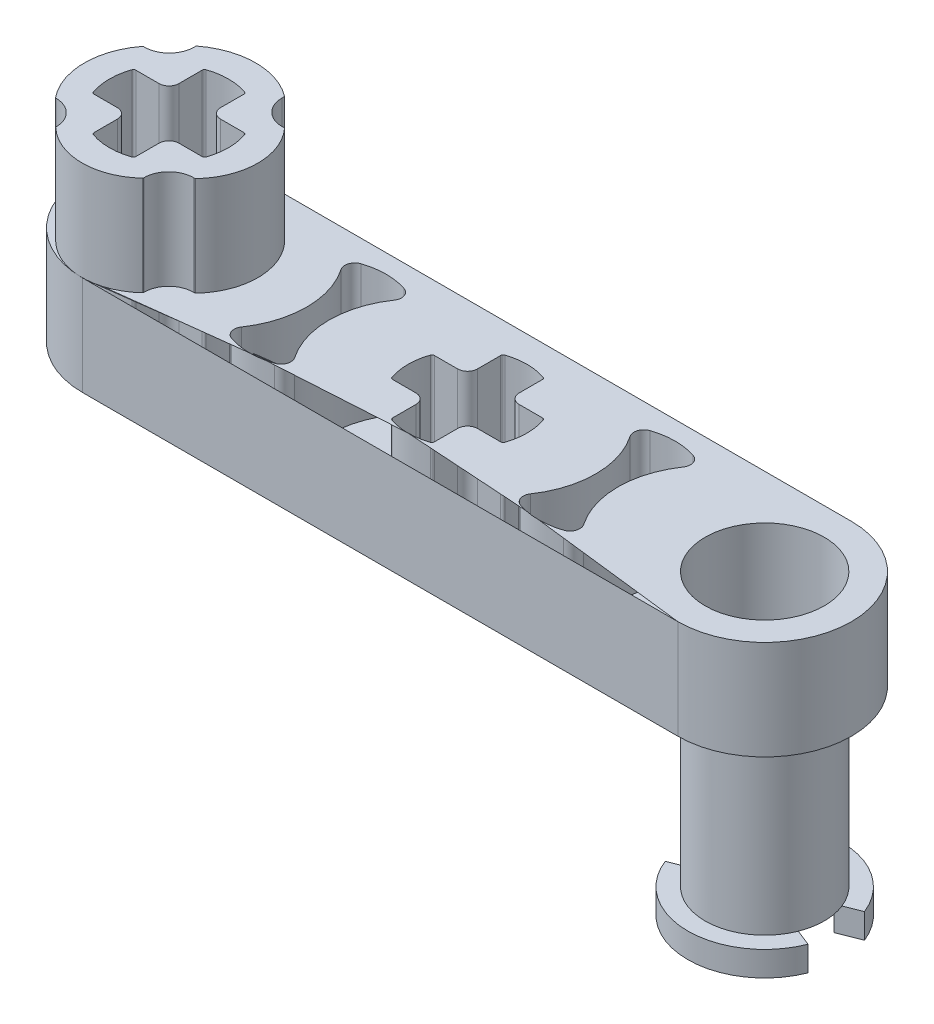
from build123d import *

# Parameters (mm, degrees)
SKETCH2_R           = 2.4
BOSS_EXTRUDE1_DEPTH = 2
BOSS_EXTRUDE2_DEPTH = 4
SKETCH2_2_OUTSIDE_W = 39.554
SKETCH2_2_OUTSIDE_H = 15.554
SKETCH2_2_OUTSIDE_R = 2.4
CUT_EXTRUDE1_DEPTH  = 8
SKETCH5_R           = 2.4
SKETCH5_R_2         = 2.15
BOSS_EXTRUDE3_DEPTH = 7
BOSS_EXTRUDE4_DEPTH = 1


with BuildPart() as part:
    # Sketch2 → Boss-Extrude1 (new, symmetric)
    with BuildSketch(Plane(origin=(0, 0, 0), x_dir=(1, 0, 0), z_dir=(0, 1, 0))):
        with BuildLine():
            Line((-4.44, 3.5), (19.56, 3.5))
            ThreePointArc((19.56, 3.5), (23.06, 0), (19.56, -3.5))
            Line((19.56, -3.5), (-4.44, -3.5))
            ThreePointArc((-4.44, -3.5), (-7.94, 0), (-4.44, 3.5))
        make_face()
        with Locations((19.56, 0)):
            Circle(SKETCH2_R, mode=Mode.SUBTRACT)
        with BuildLine():
            Line((-5.279975377, -1.253128504), (-5.279975377, -2.190833718))
            ThreePointArc((-5.279975377, -2.190833718), (-5.261269262, -2.249068625), (-5.21214929, -2.285516554))
            ThreePointArc((-5.21214929, -2.285516554), (-4.439975377, -2.413128504), (-3.667801464, -2.285516554))
            ThreePointArc((-3.667801464, -2.285516554), (-3.618681493, -2.249068625), (-3.599975377, -2.190833718))
            Line((-3.599975377, -2.190833718), (-3.599975377, -1.253128504))
            ThreePointArc((-3.599975377, -1.253128504), (-3.48281809, -0.970285792), (-3.199975377, -0.853128504))
            Line((-3.199975377, -0.853128504), (-2.262270163, -0.853128504))
            ThreePointArc((-2.262270163, -0.853128504), (-2.204035257, -0.834422389), (-2.167587328, -0.785302417))
            ThreePointArc((-2.167587328, -0.785302417), (-2.039975377, -0.013128504), (-2.167587328, 0.759045409))
            ThreePointArc((-2.167587328, 0.759045409), (-2.204035257, 0.80816538), (-2.262270163, 0.826871496))
            Line((-2.262270163, 0.826871496), (-3.199975377, 0.826871496))
            ThreePointArc((-3.199975377, 0.826871496), (-3.48281809, 0.944028783), (-3.599975377, 1.226871496))
            Line((-3.599975377, 1.226871496), (-3.599975377, 2.16457671))
            ThreePointArc((-3.599975377, 2.16457671), (-3.618681493, 2.222811617), (-3.667801464, 2.259259545))
            ThreePointArc((-3.667801464, 2.259259545), (-4.439975377, 2.386871496), (-5.21214929, 2.259259545))
            ThreePointArc((-5.21214929, 2.259259545), (-5.261269262, 2.222811617), (-5.279975377, 2.16457671))
            Line((-5.279975377, 2.16457671), (-5.279975377, 1.226871496))
            ThreePointArc((-5.279975377, 1.226871496), (-5.397132665, 0.944028783), (-5.679975377, 0.826871496))
            Line((-5.679975377, 0.826871496), (-6.617680592, 0.826871496))
            ThreePointArc((-6.617680592, 0.826871496), (-6.675915498, 0.80816538), (-6.712363427, 0.759045409))
            ThreePointArc((-6.712363427, 0.759045409), (-6.839975377, -0.013128504), (-6.712363427, -0.785302417))
            ThreePointArc((-6.712363427, -0.785302417), (-6.675915498, -0.834422389), (-6.617680592, -0.853128504))
            Line((-6.617680592, -0.853128504), (-5.679975377, -0.853128504))
            ThreePointArc((-5.679975377, -0.853128504), (-5.397132665, -0.970285792), (-5.279975377, -1.253128504))
        make_face(mode=Mode.SUBTRACT)
        with BuildLine():
            Line((6.697861167, -1.195612727), (6.697861167, -2.133317941))
            ThreePointArc((6.697861167, -2.133317941), (6.716567283, -2.191552847), (6.765687254, -2.228000776))
            ThreePointArc((6.765687254, -2.228000776), (7.537861167, -2.355612727), (8.31003508, -2.228000776))
            ThreePointArc((8.31003508, -2.228000776), (8.359155052, -2.191552847), (8.377861167, -2.133317941))
            Line((8.377861167, -2.133317941), (8.377861167, -1.195612727))
            ThreePointArc((8.377861167, -1.195612727), (8.495018455, -0.912770014), (8.777861167, -0.795612727))
            Line((8.777861167, -0.795612727), (9.715566381, -0.795612727))
            ThreePointArc((9.715566381, -0.795612727), (9.773801288, -0.776906611), (9.810249217, -0.72778664))
            ThreePointArc((9.810249217, -0.72778664), (9.937861167, 0.044387273), (9.810249217, 0.816561186))
            ThreePointArc((9.810249217, 0.816561186), (9.773801288, 0.865681158), (9.715566381, 0.884387273))
            Line((9.715566381, 0.884387273), (8.777861167, 0.884387273))
            ThreePointArc((8.777861167, 0.884387273), (8.495018455, 1.001544561), (8.377861167, 1.284387273))
            Line((8.377861167, 1.284387273), (8.377861167, 2.222092488))
            ThreePointArc((8.377861167, 2.222092488), (8.359155052, 2.280327394), (8.31003508, 2.316775323))
            ThreePointArc((8.31003508, 2.316775323), (7.537861167, 2.444387273), (6.765687254, 2.316775323))
            ThreePointArc((6.765687254, 2.316775323), (6.716567283, 2.280327394), (6.697861167, 2.222092488))
            Line((6.697861167, 2.222092488), (6.697861167, 1.284387273))
            ThreePointArc((6.697861167, 1.284387273), (6.58070388, 1.001544561), (6.297861167, 0.884387273))
            Line((6.297861167, 0.884387273), (5.360155953, 0.884387273))
            ThreePointArc((5.360155953, 0.884387273), (5.301921046, 0.865681158), (5.265473118, 0.816561186))
            ThreePointArc((5.265473118, 0.816561186), (5.137861167, 0.044387273), (5.265473118, -0.72778664))
            ThreePointArc((5.265473118, -0.72778664), (5.301921046, -0.776906611), (5.360155953, -0.795612727))
            Line((5.360155953, -0.795612727), (6.297861167, -0.795612727))
            ThreePointArc((6.297861167, -0.795612727), (6.58070388, -0.912770014), (6.697861167, -1.195612727))
        make_face(mode=Mode.SUBTRACT)
        with BuildLine():
            ThreePointArc((0.682985448, -2.610099174), (1.548942895, -2.75), (2.414900342, -2.610099174))
            ThreePointArc((2.414900342, -2.610099174), (2.667976494, -2.358251088), (2.619069477, -2.004580194))
            ThreePointArc((2.619069477, -2.004580194), (1.998942895, 0), (2.619069477, 2.004580194))
            ThreePointArc((2.619069477, 2.004580194), (2.667976494, 2.358251088), (2.414900342, 2.610099174))
            ThreePointArc((2.414900342, 2.610099174), (1.548942895, 2.75), (0.682985448, 2.610099174))
            ThreePointArc((0.682985448, 2.610099174), (0.429909296, 2.358251088), (0.478816313, 2.004580194))
            ThreePointArc((0.478816313, 2.004580194), (1.098942895, 0), (0.478816313, -2.004580194))
            ThreePointArc((0.478816313, -2.004580194), (0.429909296, -2.358251088), (0.682985448, -2.610099174))
        make_face(mode=Mode.SUBTRACT)
        with BuildLine():
            ThreePointArc((12.332973137, -2.610099174), (13.198930584, -2.75), (14.06488803, -2.610099174))
            ThreePointArc((14.06488803, -2.610099174), (14.317964183, -2.358251088), (14.269057166, -2.004580194))
            ThreePointArc((14.269057166, -2.004580194), (13.648930584, 0), (14.269057166, 2.004580194))
            ThreePointArc((14.269057166, 2.004580194), (14.317964183, 2.358251088), (14.06488803, 2.610099174))
            ThreePointArc((14.06488803, 2.610099174), (13.198930584, 2.75), (12.332973137, 2.610099174))
            ThreePointArc((12.332973137, 2.610099174), (12.079896985, 2.358251088), (12.128804001, 2.004580194))
            ThreePointArc((12.128804001, 2.004580194), (12.748930584, 0), (12.128804001, -2.004580194))
            ThreePointArc((12.128804001, -2.004580194), (12.079896985, -2.358251088), (12.332973137, -2.610099174))
        make_face(mode=Mode.SUBTRACT)
    extrude(amount=BOSS_EXTRUDE1_DEPTH, both=True)

    # Sketch3 → Boss-Extrude2 (add)
    with BuildSketch(Plane(origin=(0, 2, 0), x_dir=(1, 0, 0), z_dir=(0, 1, 0))):
        with BuildLine():
            Line((-2.699812111, 2.806112945), (-2.699812111, 2.90874331))
            ThreePointArc((-2.699812111, 2.90874331), (-4.476002964, 3.49955548), (-6.244349616, 2.88566373))
            Line((-6.244349616, 2.88566373), (-6.244349616, 2.806112945))
            ThreePointArc((-6.244349616, 2.806112945), (-6.537242835, 2.099006164), (-7.244349616, 1.806112945))
            Line((-7.244349616, 1.806112945), (-7.302442476, 1.806112945))
            ThreePointArc((-7.302442476, 1.806112945), (-7.907666717, 0.01604592), (-7.26697999, -1.761637082))
            Line((-7.26697999, -1.761637082), (-7.244349616, -1.761637082))
            ThreePointArc((-7.244349616, -1.761637082), (-6.537242835, -2.054530301), (-6.244349616, -2.761637082))
            Line((-6.244349616, -2.761637082), (-6.244349616, -2.77343784))
            ThreePointArc((-6.244349616, -2.77343784), (-4.47671825, -3.497182541), (-2.699812111, -2.79651742))
            Line((-2.699812111, -2.79651742), (-2.699812111, -2.761637082))
            ThreePointArc((-2.699812111, -2.761637082), (-2.406918892, -2.054530301), (-1.699812111, -1.761637082))
            Line((-1.699812111, -1.761637082), (-1.632644233, -1.761637082))
            ThreePointArc((-1.632644233, -1.761637082), (-0.910113093, 0.015232408), (-1.597181746, 1.806112945))
            Line((-1.597181746, 1.806112945), (-1.699812111, 1.806112945))
            ThreePointArc((-1.699812111, 1.806112945), (-2.406918892, 2.099006164), (-2.699812111, 2.806112945))
        make_face()
    extrude(amount=BOSS_EXTRUDE2_DEPTH)

    # Sketch2<2> outside → Cut-Extrude1 (cut)
    # profile 1 of 6: a face of its own
    with BuildSketch(Plane(origin=(0, 0, 0), x_dir=(1, 0, 0), z_dir=(0, 1, 0))):
        with Locations((7.56, 0)):
            Rectangle(SKETCH2_2_OUTSIDE_W, SKETCH2_2_OUTSIDE_H)
        with BuildLine():
            Line((-4.44, 3.5), (19.56, 3.5))
            ThreePointArc((19.56, 3.5), (23.06, 0), (19.56, -3.5))
            Line((19.56, -3.5), (-4.44, -3.5))
            ThreePointArc((-4.44, -3.5), (-7.94, 0), (-4.44, 3.5))
        make_face(mode=Mode.SUBTRACT)
    # profile 2 of 6: a face of its own
    with BuildSketch(Plane(origin=(0, 0, 0), x_dir=(1, 0, 0), z_dir=(0, 1, 0))):
        with Locations((19.56, 0)):
            Circle(SKETCH2_2_OUTSIDE_R)
    # profile 3 of 6: a face of its own
    with BuildSketch(Plane(origin=(0, 0, 0), x_dir=(1, 0, 0), z_dir=(0, 1, 0))):
        with BuildLine():
            Line((-5.279975377, -1.253128504), (-5.279975377, -2.190833718))
            ThreePointArc((-5.279975377, -2.190833718), (-5.261269262, -2.249068625), (-5.21214929, -2.285516554))
            ThreePointArc((-5.21214929, -2.285516554), (-4.439975377, -2.413128504), (-3.667801464, -2.285516554))
            ThreePointArc((-3.667801464, -2.285516554), (-3.618681493, -2.249068625), (-3.599975377, -2.190833718))
            Line((-3.599975377, -2.190833718), (-3.599975377, -1.253128504))
            ThreePointArc((-3.599975377, -1.253128504), (-3.48281809, -0.970285792), (-3.199975377, -0.853128504))
            Line((-3.199975377, -0.853128504), (-2.262270163, -0.853128504))
            ThreePointArc((-2.262270163, -0.853128504), (-2.204035257, -0.834422389), (-2.167587328, -0.785302417))
            ThreePointArc((-2.167587328, -0.785302417), (-2.039975377, -0.013128504), (-2.167587328, 0.759045409))
            ThreePointArc((-2.167587328, 0.759045409), (-2.204035257, 0.80816538), (-2.262270163, 0.826871496))
            Line((-2.262270163, 0.826871496), (-3.199975377, 0.826871496))
            ThreePointArc((-3.199975377, 0.826871496), (-3.48281809, 0.944028783), (-3.599975377, 1.226871496))
            Line((-3.599975377, 1.226871496), (-3.599975377, 2.16457671))
            ThreePointArc((-3.599975377, 2.16457671), (-3.618681493, 2.222811617), (-3.667801464, 2.259259545))
            ThreePointArc((-3.667801464, 2.259259545), (-4.439975377, 2.386871496), (-5.21214929, 2.259259545))
            ThreePointArc((-5.21214929, 2.259259545), (-5.261269262, 2.222811617), (-5.279975377, 2.16457671))
            Line((-5.279975377, 2.16457671), (-5.279975377, 1.226871496))
            ThreePointArc((-5.279975377, 1.226871496), (-5.397132665, 0.944028783), (-5.679975377, 0.826871496))
            Line((-5.679975377, 0.826871496), (-6.617680592, 0.826871496))
            ThreePointArc((-6.617680592, 0.826871496), (-6.675915498, 0.80816538), (-6.712363427, 0.759045409))
            ThreePointArc((-6.712363427, 0.759045409), (-6.839975377, -0.013128504), (-6.712363427, -0.785302417))
            ThreePointArc((-6.712363427, -0.785302417), (-6.675915498, -0.834422389), (-6.617680592, -0.853128504))
            Line((-6.617680592, -0.853128504), (-5.679975377, -0.853128504))
            ThreePointArc((-5.679975377, -0.853128504), (-5.397132665, -0.970285792), (-5.279975377, -1.253128504))
        make_face()
    # profile 4 of 6: a face of its own
    with BuildSketch(Plane(origin=(0, 0, 0), x_dir=(1, 0, 0), z_dir=(0, 1, 0))):
        with BuildLine():
            Line((6.697861167, -1.195612727), (6.697861167, -2.133317941))
            ThreePointArc((6.697861167, -2.133317941), (6.716567283, -2.191552847), (6.765687254, -2.228000776))
            ThreePointArc((6.765687254, -2.228000776), (7.537861167, -2.355612727), (8.31003508, -2.228000776))
            ThreePointArc((8.31003508, -2.228000776), (8.359155052, -2.191552847), (8.377861167, -2.133317941))
            Line((8.377861167, -2.133317941), (8.377861167, -1.195612727))
            ThreePointArc((8.377861167, -1.195612727), (8.495018455, -0.912770014), (8.777861167, -0.795612727))
            Line((8.777861167, -0.795612727), (9.715566381, -0.795612727))
            ThreePointArc((9.715566381, -0.795612727), (9.773801288, -0.776906611), (9.810249217, -0.72778664))
            ThreePointArc((9.810249217, -0.72778664), (9.937861167, 0.044387273), (9.810249217, 0.816561186))
            ThreePointArc((9.810249217, 0.816561186), (9.773801288, 0.865681158), (9.715566381, 0.884387273))
            Line((9.715566381, 0.884387273), (8.777861167, 0.884387273))
            ThreePointArc((8.777861167, 0.884387273), (8.495018455, 1.001544561), (8.377861167, 1.284387273))
            Line((8.377861167, 1.284387273), (8.377861167, 2.222092488))
            ThreePointArc((8.377861167, 2.222092488), (8.359155052, 2.280327394), (8.31003508, 2.316775323))
            ThreePointArc((8.31003508, 2.316775323), (7.537861167, 2.444387273), (6.765687254, 2.316775323))
            ThreePointArc((6.765687254, 2.316775323), (6.716567283, 2.280327394), (6.697861167, 2.222092488))
            Line((6.697861167, 2.222092488), (6.697861167, 1.284387273))
            ThreePointArc((6.697861167, 1.284387273), (6.58070388, 1.001544561), (6.297861167, 0.884387273))
            Line((6.297861167, 0.884387273), (5.360155953, 0.884387273))
            ThreePointArc((5.360155953, 0.884387273), (5.301921046, 0.865681158), (5.265473118, 0.816561186))
            ThreePointArc((5.265473118, 0.816561186), (5.137861167, 0.044387273), (5.265473118, -0.72778664))
            ThreePointArc((5.265473118, -0.72778664), (5.301921046, -0.776906611), (5.360155953, -0.795612727))
            Line((5.360155953, -0.795612727), (6.297861167, -0.795612727))
            ThreePointArc((6.297861167, -0.795612727), (6.58070388, -0.912770014), (6.697861167, -1.195612727))
        make_face()
    # profile 5 of 6: a face of its own
    with BuildSketch(Plane(origin=(0, 0, 0), x_dir=(1, 0, 0), z_dir=(0, 1, 0))):
        with BuildLine():
            ThreePointArc((0.682985448, -2.610099174), (1.548942895, -2.75), (2.414900342, -2.610099174))
            ThreePointArc((2.414900342, -2.610099174), (2.667976494, -2.358251088), (2.619069477, -2.004580194))
            ThreePointArc((2.619069477, -2.004580194), (1.998942895, 0), (2.619069477, 2.004580194))
            ThreePointArc((2.619069477, 2.004580194), (2.667976494, 2.358251088), (2.414900342, 2.610099174))
            ThreePointArc((2.414900342, 2.610099174), (1.548942895, 2.75), (0.682985448, 2.610099174))
            ThreePointArc((0.682985448, 2.610099174), (0.429909296, 2.358251088), (0.478816313, 2.004580194))
            ThreePointArc((0.478816313, 2.004580194), (1.098942895, 0), (0.478816313, -2.004580194))
            ThreePointArc((0.478816313, -2.004580194), (0.429909296, -2.358251088), (0.682985448, -2.610099174))
        make_face()
    # profile 6 of 6: a face of its own
    with BuildSketch(Plane(origin=(0, 0, 0), x_dir=(1, 0, 0), z_dir=(0, 1, 0))):
        with BuildLine():
            ThreePointArc((12.332973137, -2.610099174), (13.198930584, -2.75), (14.06488803, -2.610099174))
            ThreePointArc((14.06488803, -2.610099174), (14.317964183, -2.358251088), (14.269057166, -2.004580194))
            ThreePointArc((14.269057166, -2.004580194), (13.648930584, 0), (14.269057166, 2.004580194))
            ThreePointArc((14.269057166, 2.004580194), (14.317964183, 2.358251088), (14.06488803, 2.610099174))
            ThreePointArc((14.06488803, 2.610099174), (13.198930584, 2.75), (12.332973137, 2.610099174))
            ThreePointArc((12.332973137, 2.610099174), (12.079896985, 2.358251088), (12.128804001, 2.004580194))
            ThreePointArc((12.128804001, 2.004580194), (12.748930584, 0), (12.128804001, -2.004580194))
            ThreePointArc((12.128804001, -2.004580194), (12.079896985, -2.358251088), (12.332973137, -2.610099174))
        make_face()
    extrude(amount=CUT_EXTRUDE1_DEPTH, mode=Mode.SUBTRACT)


with BuildPart() as body_2:
    # Sketch5 → Boss-Extrude3 (new body)
    with BuildSketch(Plane.XZ.offset(2)):
        with Locations((19.56, 0)):
            Circle(SKETCH5_R)
        with Locations((19.56, 0)):
            Circle(SKETCH5_R_2, mode=Mode.SUBTRACT)
    extrude(amount=BOSS_EXTRUDE3_DEPTH)

    # Sketch6 → Boss-Extrude4 (add)
    with BuildSketch(Plane.XZ.offset(9)):
        with BuildLine():
            Line((16.669151351, 1.119372185), (17.555056582, 0.776338773))
            ThreePointArc((17.555056582, 0.776338773), (19.553210169, 2.149989279), (21.56, 0.788986692))
            Line((21.56, 0.788986692), (22.44372093, 1.137608719))
            ThreePointArc((22.44372093, 1.137608719), (19.550210011, 3.099984541), (16.669151351, 1.119372185))
        make_face()
        with BuildLine():
            Line((17.555056582, -0.776338773), (16.669151351, -1.119372185))
            ThreePointArc((16.669151351, -1.119372185), (19.550210011, -3.099984541), (22.44372093, -1.137608719))
            Line((22.44372093, -1.137608719), (21.56, -0.788986692))
            ThreePointArc((21.56, -0.788986692), (19.553210169, -2.149989279), (17.555056582, -0.776338773))
        make_face()
    extrude(amount=BOSS_EXTRUDE4_DEPTH)


solid = Compound([part.part, body_2.part])
